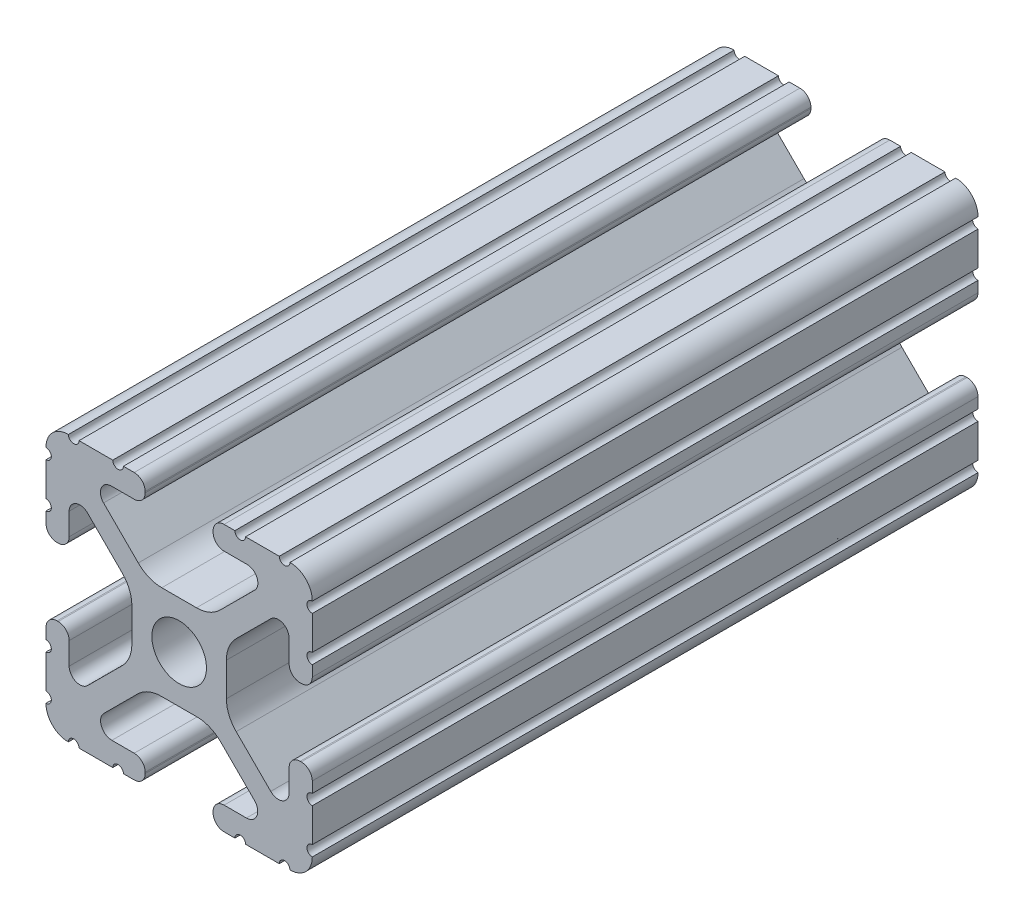
from build123d import *

# Parameters (mm, degrees)
SKETCH1_R      = 2.6035
EXTRUDE1_DEPTH = 63.5


with BuildPart() as part:
    # Sketch1 → Extrude1 (new body)
    with BuildSketch(Plane.XY):
        with BuildLine():
            Line((-7.207036008, 8.724370562), (-3.898272566, 5.423169045))
            ThreePointArc((-3.898272566, 5.423169045), (-2.869120213, 4.736787962), (-1.655778399, 4.4958))
            Line((-1.655778399, 4.4958), (1.655778399, 4.4958))
            ThreePointArc((1.655778399, 4.4958), (2.869120213, 4.736787962), (3.898272566, 5.423169045))
            Line((3.898272566, 5.423169045), (7.207036008, 8.724370562))
            ThreePointArc((7.207036008, 8.724370562), (7.432222385, 9.85140422), (6.476788598, 10.4902))
            Line((6.476788598, 10.4902), (4.287512407, 10.4902))
            ThreePointArc((4.287512407, 10.4902), (3.54574862, 10.79744862), (3.2385, 11.539212407))
            Line((3.2385, 11.539212407), (3.2385, 11.650987593))
            ThreePointArc((3.2385, 11.650987593), (3.54574862, 12.39275138), (4.287512407, 12.7))
            Line((4.287512407, 12.7), (5.317126718, 12.7))
            ThreePointArc((5.317126718, 12.7), (5.825126718, 12.192), (6.333126718, 12.7))
            Line((6.333126718, 12.7), (9.550443118, 12.7))
            ThreePointArc((9.550443118, 12.7), (10.058366869, 12.192000006), (10.566443095, 12.699847501))
            ThreePointArc((10.566443095, 12.699847501), (12.082537762, 12.08250727), (12.699846982, 10.566399977))
            ThreePointArc((12.699846982, 10.566399977), (12.192000006, 10.058323491), (12.7, 9.5504))
            Line((12.7, 9.5504), (12.7, 6.3330836))
            ThreePointArc((12.7, 6.3330836), (12.192, 5.8250836), (12.7, 5.3170836))
            Line((12.7, 5.3170836), (12.7, 4.287469289))
            ThreePointArc((12.7, 4.287469289), (12.39275138, 3.545705502), (11.650987593, 3.238456882))
            Line((11.650987593, 3.238456882), (11.539212407, 3.238456882))
            ThreePointArc((11.539212407, 3.238456882), (10.79744862, 3.545705502), (10.4902, 4.287469289))
            Line((10.4902, 4.287469289), (10.4902, 6.402089023))
            ThreePointArc((10.4902, 6.402089023), (9.856505071, 7.351067942), (8.737131347, 7.129408934))
            Line((8.737131347, 7.129408934), (5.441005833, 3.840816462))
            ThreePointArc((5.441005833, 3.840816462), (4.750877967, 2.809883091), (4.5085, 1.593185507))
            Line((4.5085, 1.593185507), (4.5085, -1.593185507))
            ThreePointArc((4.5085, -1.593185507), (4.750877967, -2.809883091), (5.441005833, -3.840816462))
            Line((5.441005833, -3.840816462), (8.737131347, -7.129408934))
            ThreePointArc((8.737131347, -7.129408934), (9.856505071, -7.351067942), (10.4902, -6.402089023))
            Line((10.4902, -6.402089023), (10.4902, -4.287469289))
            ThreePointArc((10.4902, -4.287469289), (10.79744862, -3.545705502), (11.539212407, -3.238456882))
            Line((11.539212407, -3.238456882), (11.650987593, -3.238456882))
            ThreePointArc((11.650987593, -3.238456882), (12.39275138, -3.545705502), (12.7, -4.287469289))
            Line((12.7, -4.287469289), (12.7, -5.3170836))
            ThreePointArc((12.7, -5.3170836), (12.192, -5.8250836), (12.7, -6.3330836))
            Line((12.7, -6.3330836), (12.7, -9.5504))
            ThreePointArc((12.7, -9.5504), (12.192000006, -10.058323491), (12.699846982, -10.566399977))
            ThreePointArc((12.699846982, -10.566399977), (12.082537762, -12.08250727), (10.566443095, -12.699847501))
            ThreePointArc((10.566443095, -12.699847501), (10.058366869, -12.192000006), (9.550443118, -12.7))
            Line((9.550443118, -12.7), (6.333126718, -12.7))
            ThreePointArc((6.333126718, -12.7), (5.825126718, -12.192), (5.317126718, -12.7))
            Line((5.317126718, -12.7), (4.287512407, -12.7))
            ThreePointArc((4.287512407, -12.7), (3.54574862, -12.39275138), (3.2385, -11.650987593))
            Line((3.2385, -11.650987593), (3.2385, -11.539212407))
            ThreePointArc((3.2385, -11.539212407), (3.54574862, -10.79744862), (4.287512407, -10.4902))
            Line((4.287512407, -10.4902), (6.416408329, -10.4902))
            ThreePointArc((6.416408329, -10.4902), (7.41473083, -9.822813117), (7.179650497, -8.645192506))
            Line((7.179650497, -8.645192506), (3.952270251, -5.423690499))
            ThreePointArc((3.952270251, -5.423690499), (2.922936451, -4.736929036), (1.709253557, -4.4958))
            Line((1.709253557, -4.4958), (-1.709253557, -4.4958))
            ThreePointArc((-1.709253557, -4.4958), (-2.922936451, -4.736929036), (-3.952270251, -5.423690499))
            Line((-3.952270251, -5.423690499), (-7.179650497, -8.645192506))
            ThreePointArc((-7.179650497, -8.645192506), (-7.41473083, -9.822813117), (-6.416408329, -10.4902))
            Line((-6.416408329, -10.4902), (-4.287512407, -10.4902))
            ThreePointArc((-4.287512407, -10.4902), (-3.54574862, -10.79744862), (-3.2385, -11.539212407))
            Line((-3.2385, -11.539212407), (-3.2385, -11.650987593))
            ThreePointArc((-3.2385, -11.650987593), (-3.54574862, -12.39275138), (-4.287512407, -12.7))
            Line((-4.287512407, -12.7), (-5.317126718, -12.7))
            ThreePointArc((-5.317126718, -12.7), (-5.825126718, -12.192), (-6.333126718, -12.7))
            Line((-6.333126718, -12.7), (-9.550443118, -12.7))
            ThreePointArc((-9.550443118, -12.7), (-10.058366869, -12.192000006), (-10.566443095, -12.699847501))
            ThreePointArc((-10.566443095, -12.699847501), (-12.082537762, -12.08250727), (-12.699846982, -10.566399977))
            ThreePointArc((-12.699846982, -10.566399977), (-12.192000006, -10.058323491), (-12.7, -9.5504))
            Line((-12.7, -9.5504), (-12.7, -6.3330836))
            ThreePointArc((-12.7, -6.3330836), (-12.192, -5.8250836), (-12.7, -5.3170836))
            Line((-12.7, -5.3170836), (-12.7, -4.287469289))
            ThreePointArc((-12.7, -4.287469289), (-12.39275138, -3.545705502), (-11.650987593, -3.238456882))
            Line((-11.650987593, -3.238456882), (-11.539212407, -3.238456882))
            ThreePointArc((-11.539212407, -3.238456882), (-10.79744862, -3.545705502), (-10.4902, -4.287469289))
            Line((-10.4902, -4.287469289), (-10.4902, -6.402089023))
            ThreePointArc((-10.4902, -6.402089023), (-9.856505071, -7.351067942), (-8.737131347, -7.129408934))
            Line((-8.737131347, -7.129408934), (-5.441005833, -3.840816462))
            ThreePointArc((-5.441005833, -3.840816462), (-4.750877967, -2.809883091), (-4.5085, -1.593185507))
            Line((-4.5085, -1.593185507), (-4.5085, 1.593185507))
            ThreePointArc((-4.5085, 1.593185507), (-4.750877967, 2.809883091), (-5.441005833, 3.840816462))
            Line((-5.441005833, 3.840816462), (-8.737131347, 7.129408934))
            ThreePointArc((-8.737131347, 7.129408934), (-9.856505071, 7.351067942), (-10.4902, 6.402089023))
            Line((-10.4902, 6.402089023), (-10.4902, 4.287469289))
            ThreePointArc((-10.4902, 4.287469289), (-10.79744862, 3.545705502), (-11.539212407, 3.238456882))
            Line((-11.539212407, 3.238456882), (-11.650987593, 3.238456882))
            ThreePointArc((-11.650987593, 3.238456882), (-12.39275138, 3.545705502), (-12.7, 4.287469289))
            Line((-12.7, 4.287469289), (-12.7, 5.3170836))
            ThreePointArc((-12.7, 5.3170836), (-12.192, 5.8250836), (-12.7, 6.3330836))
            Line((-12.7, 6.3330836), (-12.7, 9.5504))
            ThreePointArc((-12.7, 9.5504), (-12.192000006, 10.058323491), (-12.699846982, 10.566399977))
            ThreePointArc((-12.699846982, 10.566399977), (-12.082537762, 12.08250727), (-10.566443095, 12.699847501))
            ThreePointArc((-10.566443095, 12.699847501), (-10.058366869, 12.192000006), (-9.550443118, 12.7))
            Line((-9.550443118, 12.7), (-6.333126718, 12.7))
            ThreePointArc((-6.333126718, 12.7), (-5.825126718, 12.192), (-5.317126718, 12.7))
            Line((-5.317126718, 12.7), (-4.287512407, 12.7))
            ThreePointArc((-4.287512407, 12.7), (-3.54574862, 12.39275138), (-3.2385, 11.650987593))
            Line((-3.2385, 11.650987593), (-3.2385, 11.539212407))
            ThreePointArc((-3.2385, 11.539212407), (-3.54574862, 10.79744862), (-4.287512407, 10.4902))
            Line((-4.287512407, 10.4902), (-6.476788598, 10.4902))
            ThreePointArc((-6.476788598, 10.4902), (-7.432222385, 9.85140422), (-7.207036008, 8.724370562))
        make_face()
        Circle(SKETCH1_R, mode=Mode.SUBTRACT)
    extrude(amount=-EXTRUDE1_DEPTH)


solid = part.part
